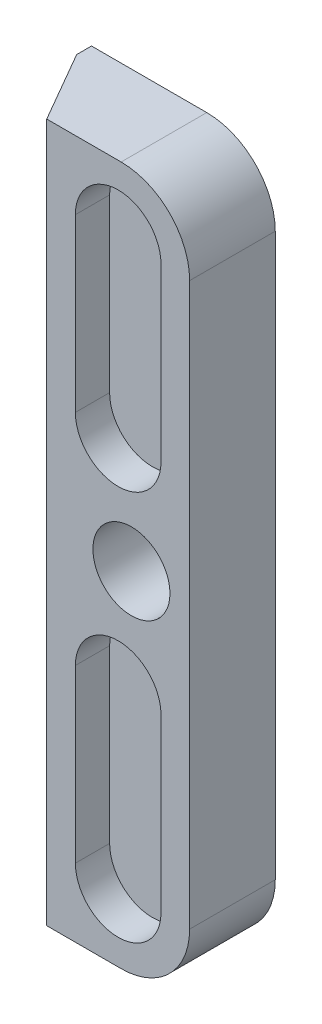
from build123d import *

# Parameters (mm, degrees)
EXTRUDE_1_DEPTH     = 40.8
FILLET_1_R          = 4
CUT_EXTRUDE_1_DEPTH = 2
HOLE_WIZARD_M41_D   = 4.5
CHAMFER_1_SIZE      = 0.5
CHAMFER_1_SIZE2     = 1


with BuildPart() as part:
    # Эскиз1 → Бобышка-Вытянуть1 (new body)
    with BuildSketch(Plane(origin=(0, 0, 0), x_dir=(1, 0, 0), z_dir=(0, 1, 0))):
        Polygon((0, 0), (0, 5), (-11.232050808, 5), (-8.345299462, 0), align=None)
    extrude(amount=EXTRUDE_1_DEPTH)

    # Скругление1
    fillet_1_edges = [part.edges().sort_by_distance(p)[0] for p in [
        (0, 0, -2.5),
        (0, 40.8, -2.5),
    ]]
    fillet(fillet_1_edges, radius=FILLET_1_R)

    # Эскиз4 → Вырез-Вытянуть1 (cut)
    with BuildSketch(Plane.XY):
        with BuildLine():
            Line((-1.672649731, 36.8), (-1.672649731, 26.8))
            ThreePointArc((-1.672649731, 26.8), (-4.172649731, 24.3), (-6.672649731, 26.8))
            Line((-6.672649731, 26.8), (-6.672649731, 36.8))
            ThreePointArc((-6.672649731, 36.8), (-4.172649731, 39.3), (-1.672649731, 36.8))
        make_face()
        with BuildLine():
            Line((-1.672649731, 4), (-1.672649731, 14))
            ThreePointArc((-1.672649731, 14), (-4.172649731, 16.5), (-6.672649731, 14))
            Line((-6.672649731, 14), (-6.672649731, 4))
            ThreePointArc((-6.672649731, 4), (-4.172649731, 1.5), (-1.672649731, 4))
        make_face()
    extrude(amount=-CUT_EXTRUDE_1_DEPTH, mode=Mode.SUBTRACT)

    # Отверстие с зазором M41 (through all)
    with Locations(Plane.XY):
        with Locations((-3.4, 20.4)):
            Hole(HOLE_WIZARD_M41_D / 2)

    # Фаска1
    chamfer_1_edges = [part.edges().sort_by_distance(p)[0] for p in [
        (-11.232050808, 20.4, -5),
    ]]
    chamfer_1_side = [part.faces().sort_by_distance(p)[0] for p in [
        (-5.771423716, 20.4, -5),
    ]]
    chamfer(chamfer_1_edges, length=CHAMFER_1_SIZE, length2=CHAMFER_1_SIZE2, reference=chamfer_1_side[0])


solid = part.part
